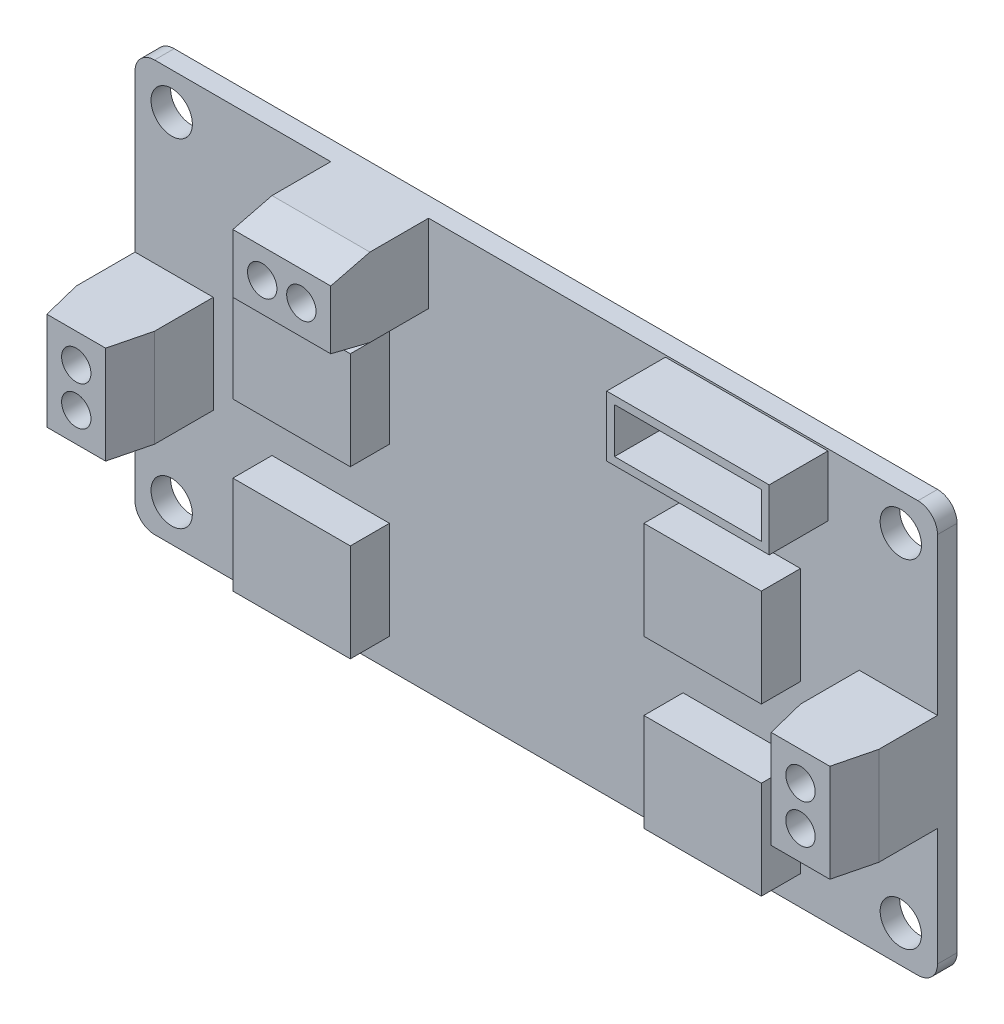
from build123d import *

# Parameters (mm, degrees)
EXTRUDE_1_DEPTH          = 2
SKETCH_2_R               = 2.112337694
CUT_EXTRUDE_1_DEPTH      = 2
MIRROR_2_COPY_1_SKETCH_R = 2.112337694
MIRROR_2_COPY_1_DEPTH    = 2
SKETCH_3_W               = 8
SKETCH_3_H               = 10
EXTRUDE_2_DEPTH          = 10
CUT_EXTRUDE_2_DEPTH      = 10
SKETCH_5_R               = 1.5
CUT_EXTRUDE_3_DEPTH      = 8
SKETCH_6_W               = 10
SKETCH_6_H               = 8
EXTRUDE_3_DEPTH          = 10
CUT_EXTRUDE_4_DEPTH      = 10
SKETCH_8_R               = 1.5
CUT_EXTRUDE_5_DEPTH      = 8
SKETCH_9_W               = 16.6
SKETCH_9_H               = 6.196182774
SKETCH_9_W_2             = 15
SKETCH_9_H_2             = 4.596182774
EXTRUDE_1_2_DEPTH        = 6
SKETCH_10_W              = 12
SKETCH_10_H              = 10
EXTRUDE_4_DEPTH          = 4
SKETCH_12_W              = 12
SKETCH_12_H              = 10
EXTRUDE_5_DEPTH          = 4


with BuildPart() as part:
    # 草图1 → Extrude 1 (new body)
    with BuildSketch(Plane.XY):
        with BuildLine():
            Line((-39, 21), (39, 21))
            ThreePointArc((39, 21), (40.414213562, 20.414213562), (41, 19))
            Line((41, 19), (41, -19))
            ThreePointArc((41, -19), (40.414213562, -20.414213562), (39, -21))
            Line((39, -21), (-39, -21))
            ThreePointArc((-39, -21), (-40.414213562, -20.414213562), (-41, -19))
            Line((-41, -19), (-41, 19))
            ThreePointArc((-41, 19), (-40.414213562, 20.414213562), (-39, 21))
        make_face()
    extrude(amount=EXTRUDE_1_DEPTH)

    # 草图2 → 切除-拉伸1 (cut)
    with BuildSketch(Plane.XY.offset(2)):
        with Locations((-37.25, 17.25)):
            Circle(SKETCH_2_R)
    cut_extrude_1 = extrude(amount=-CUT_EXTRUDE_1_DEPTH, mode=Mode.SUBTRACT)

    # 镜向1: 切除-拉伸1 across plane
    add(cut_extrude_1.mirror(Plane.ZX), mode=Mode.SUBTRACT)

    # 镜向2: 切除-拉伸1 across plane
    add(cut_extrude_1.mirror(Plane(origin=(0, 0, 0), x_dir=(0, 0, 1), z_dir=(1, 0, 0))), mode=Mode.SUBTRACT)

    # 镜向2 copy 1 sketch → 镜向2 copy 1 (cut)
    with BuildSketch(Plane(origin=(0, 0, 2), x_dir=(-1, 0, 0), z_dir=(0, 0, 1))):
        with Locations((-37.25, 17.25)):
            Circle(MIRROR_2_COPY_1_SKETCH_R)
    extrude(amount=-MIRROR_2_COPY_1_DEPTH, mode=Mode.SUBTRACT)

    # 草图3 → 凸台-拉伸2 (add)
    with BuildSketch(Plane.XY.offset(2)):
        with Locations((-37, -2)):
            Rectangle(SKETCH_3_W, SKETCH_3_H)
    extrude_2 = extrude(amount=EXTRUDE_2_DEPTH)

    # 草图4 → 切除-拉伸2 (cut)
    with BuildSketch(Plane.XZ.offset(7)):
        Polygon((-40, 12), (-41, 8), (-41, 12), align=None)
        Polygon((-33, 12), (-34, 12), (-33, 8), align=None)
    cut_extrude_2 = extrude(amount=-CUT_EXTRUDE_2_DEPTH, mode=Mode.SUBTRACT)

    # 草图5 → 切除-拉伸3 (cut)
    with BuildSketch(Plane.XY.offset(12)):
        with Locations((-37, 0)):
            Circle(SKETCH_5_R)
        with Locations((-37, -4)):
            Circle(SKETCH_5_R)
    cut_extrude_3 = extrude(amount=-CUT_EXTRUDE_3_DEPTH, mode=Mode.SUBTRACT)

    # 镜向3: 凸台-拉伸2, 切除-拉伸2, 切除-拉伸3 across plane
    add(extrude_2.mirror(Plane(origin=(0, 0, 0), x_dir=(0, 0, 1), z_dir=(1, 0, 0))))
    add(cut_extrude_2.mirror(Plane(origin=(0, 0, 0), x_dir=(0, 0, 1), z_dir=(1, 0, 0))), mode=Mode.SUBTRACT)
    add(cut_extrude_3.mirror(Plane(origin=(0, 0, 0), x_dir=(0, 0, 1), z_dir=(1, 0, 0))), mode=Mode.SUBTRACT)

    # 草图6 → 凸台-拉伸3 (add)
    with BuildSketch(Plane.XY.offset(2)):
        with Locations((-16, 17)):
            Rectangle(SKETCH_6_W, SKETCH_6_H)
    extrude(amount=EXTRUDE_3_DEPTH)

    # 草图7 → 切除-拉伸4 (cut)
    with BuildSketch(Plane.ZY.offset(21)):
        Polygon((8, 21), (12, 20), (12, 21), align=None)
        Polygon((12, 13), (8, 13), (12, 14), align=None)
    extrude(amount=-CUT_EXTRUDE_4_DEPTH, mode=Mode.SUBTRACT)

    # 草图8 → 切除-拉伸5 (cut)
    with BuildSketch(Plane.XY.offset(12)):
        with Locations((-14, 17)):
            Circle(SKETCH_8_R)
        with Locations((-18, 17)):
            Circle(SKETCH_8_R)
    extrude(amount=-CUT_EXTRUDE_5_DEPTH, mode=Mode.SUBTRACT)

    # 草图9 → Extrude 1 2 (add)
    with BuildSketch(Plane.XY.offset(2)):
        with Locations((21.5, 17.701908613)):
            Rectangle(SKETCH_9_W, SKETCH_9_H)
        with Locations((21.5, 17.701908613)):
            Rectangle(SKETCH_9_W_2, SKETCH_9_H_2, mode=Mode.SUBTRACT)
    extrude(amount=EXTRUDE_1_2_DEPTH)

    # 草图10 → 凸台-拉伸4 (add)
    with BuildSketch(Plane.XY.offset(2)):
        with Locations((-21, 4)):
            Rectangle(SKETCH_10_W, SKETCH_10_H)
    extrude_4 = extrude(amount=EXTRUDE_4_DEPTH)

    # 草图12 → 凸台-拉伸5 (add)
    with BuildSketch(Plane.XY.offset(2)):
        with Locations((-21, -13)):
            Rectangle(SKETCH_12_W, SKETCH_12_H)
    extrude_5 = extrude(amount=EXTRUDE_5_DEPTH)

    # 镜向4: 凸台-拉伸4, 凸台-拉伸5 across plane
    add(extrude_4.mirror(Plane(origin=(0, 0, 0), x_dir=(0, 0, 1), z_dir=(1, 0, 0))))
    add(extrude_5.mirror(Plane(origin=(0, 0, 0), x_dir=(0, 0, 1), z_dir=(1, 0, 0))))


solid = part.part
